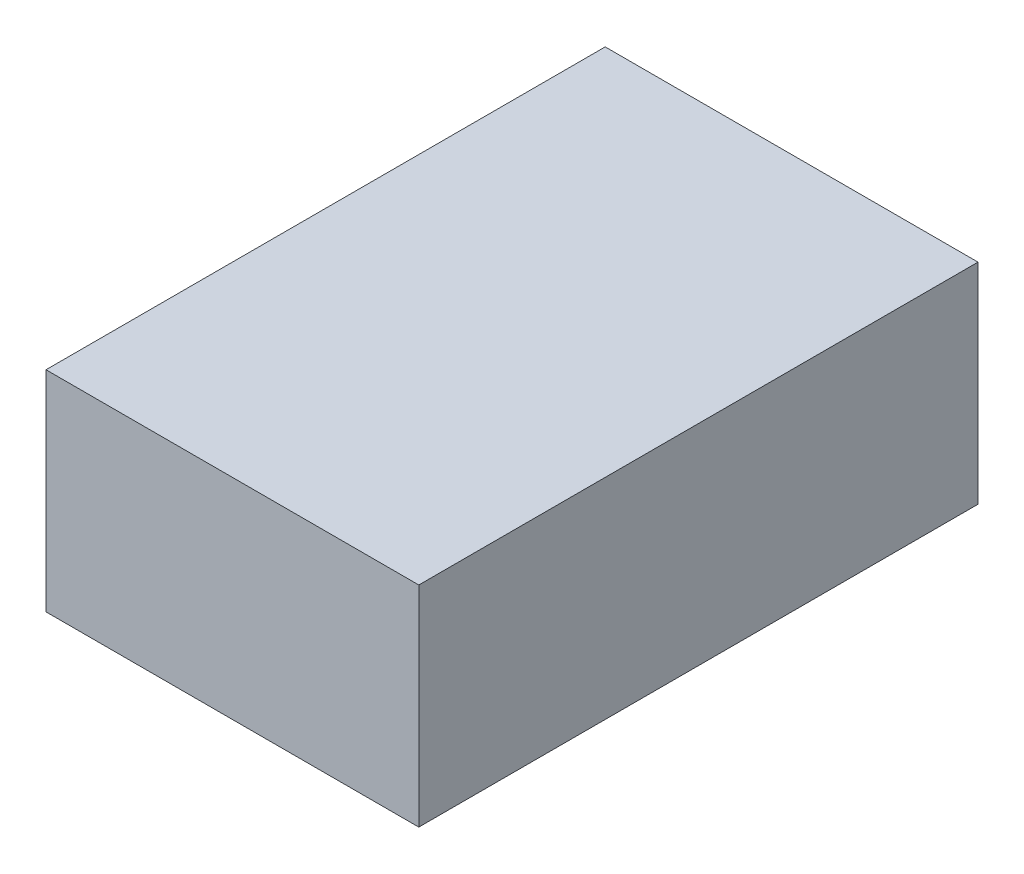
from build123d import *

# Parameters (mm, degrees)
SKETCH1_W           = 50.8
SKETCH1_H           = 28.575
BOSS_EXTRUDE1_DEPTH = 76.2


with BuildPart() as part:
    # Sketch1 → Boss-Extrude1 (new body)
    with BuildSketch(Plane.XY):
        Rectangle(SKETCH1_W, SKETCH1_H)
    extrude(amount=-BOSS_EXTRUDE1_DEPTH)


solid = part.part
